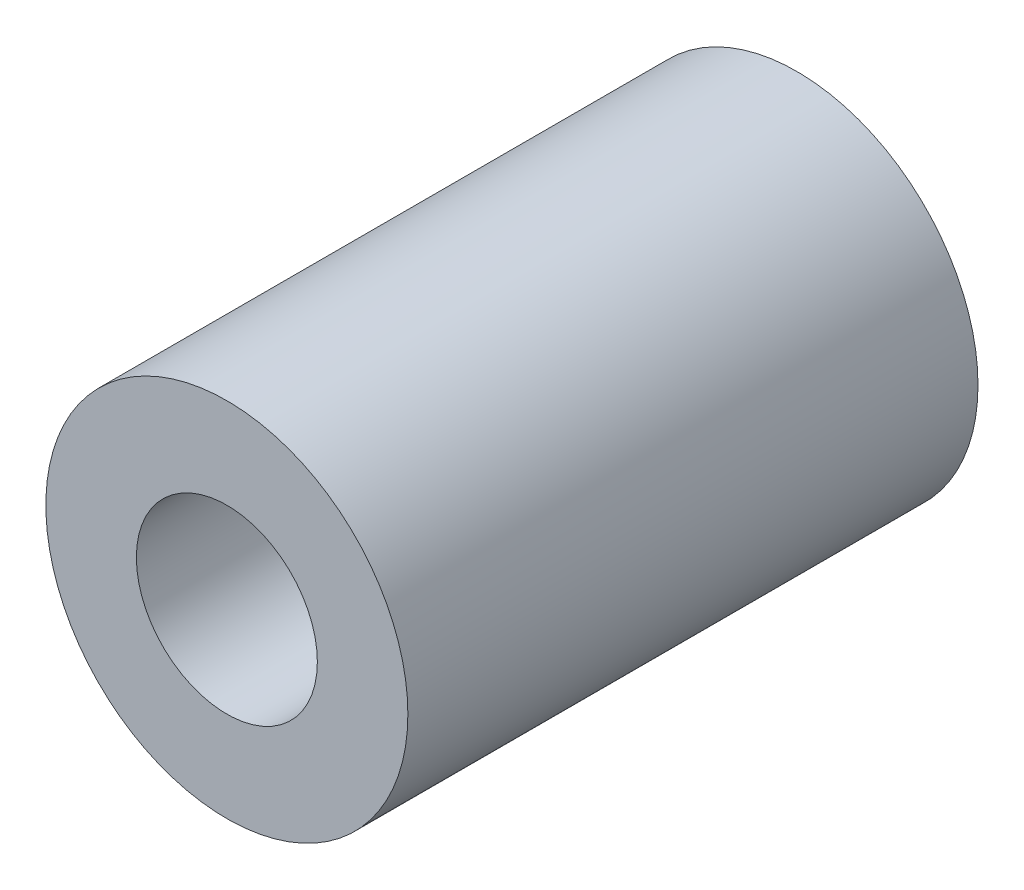
from build123d import *

# Parameters (mm, degrees)
SKETCH1_R           = 3.175
SKETCH1_R_2         = 1.5875
BOSS_EXTRUDE1_DEPTH = 10


with BuildPart() as part:
    # Sketch1 → Boss-Extrude1 (new body)
    with BuildSketch(Plane.XY):
        Circle(SKETCH1_R)
        Circle(SKETCH1_R_2, mode=Mode.SUBTRACT)
    extrude(amount=BOSS_EXTRUDE1_DEPTH)


solid = part.part
